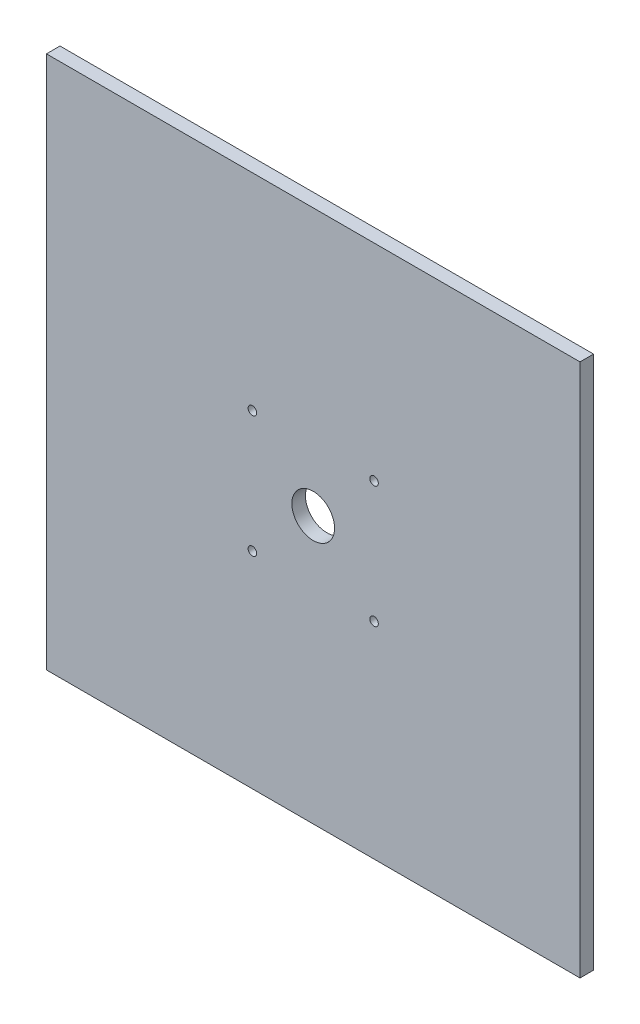
from build123d import *

# Parameters (mm, degrees)
SKETCH1_W                   = 500
SKETCH1_H                   = 500
BOSS_EXTRUDE1_DEPTH         = 12.7
SKETCH4_R                   = 20
CUT_EXTRUDE1_DEPTH          = 12.7
F_8_0_MM_DOWEL_HOLES1_D     = 8
F_8_0_MM_DOWEL_HOLES1_DEPTH = 19.75
F_8_0_MM_DOWEL_HOLES1_TIP   = 2.403442476


with BuildPart() as part:
    # Sketch1 → Boss-Extrude1 (new body)
    with BuildSketch(Plane.XY):
        Rectangle(SKETCH1_W, SKETCH1_H)
    extrude(amount=BOSS_EXTRUDE1_DEPTH)

    # Sketch4 → Cut-Extrude1 (cut)
    with BuildSketch(Plane.XY.offset(12.7)):
        Circle(SKETCH4_R)
    extrude(amount=-CUT_EXTRUDE1_DEPTH, mode=Mode.SUBTRACT)

    # Ø8.0 mm Dowel Holes1
    with Locations(Plane(origin=(0, 0, 0), x_dir=(-1, 0, 0), z_dir=(0, 0, -1))):
        with Locations((57, 57), (-57, 57), (-57, -57), (57, -57)):
            Hole(F_8_0_MM_DOWEL_HOLES1_D / 2, depth=F_8_0_MM_DOWEL_HOLES1_DEPTH)
            with Locations((0, 0, -(F_8_0_MM_DOWEL_HOLES1_DEPTH + F_8_0_MM_DOWEL_HOLES1_TIP / 2))):  # 118° drill point
                Cone(0, F_8_0_MM_DOWEL_HOLES1_D / 2, F_8_0_MM_DOWEL_HOLES1_TIP, mode=Mode.SUBTRACT)


solid = part.part
